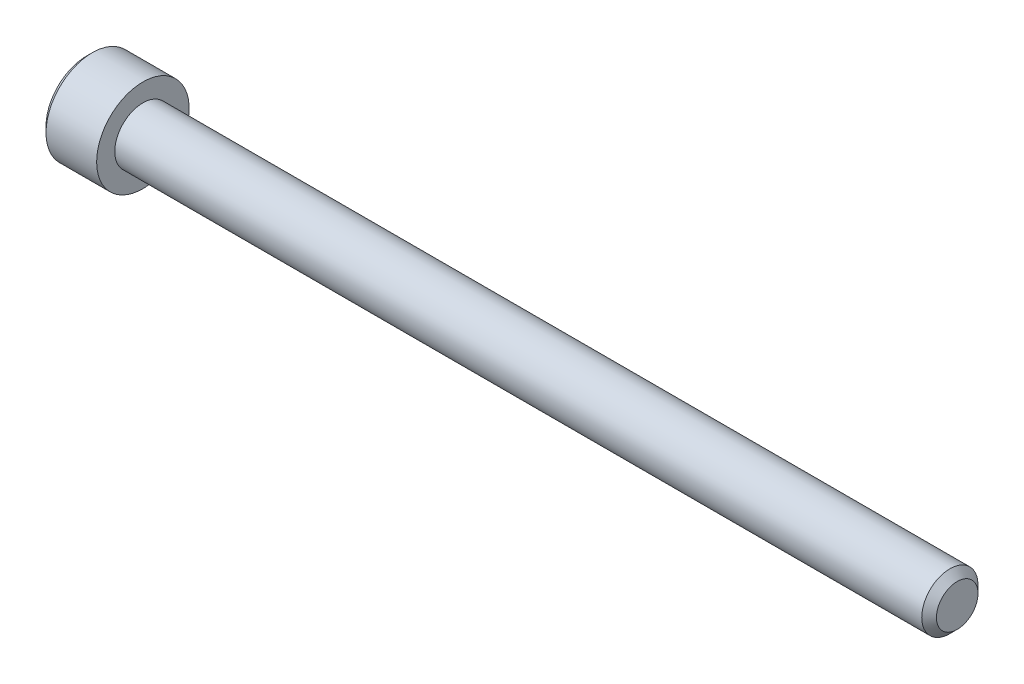
from build123d import *

# Parameters (mm, degrees)
HEXDRIVE_DEPTH = 2.286


with BuildPart() as part:
    # BodySketch → BaseBody (revolve)
    with BuildSketch(Plane(origin=(0, 0, 0), x_dir=(1, 0, 0), z_dir=(0, 1, 0)), mode=Mode.PRIVATE) as basebody_sk:
        Polygon((0, 2.413), (0, 3.96875), (-4.3434, 3.96875), (-4.826, 3.48615), (-4.826, 0), (69.85, 0), (69.85, 1.78308), (69.22008, 2.413), align=None)
    revolve(basebody_sk.sketch.rotate(Axis((-4.826, 0, 0), (1, 0, 0)), 180), axis=Axis((-4.826, 0, 0), (1, 0, 0)))

    # DriveSketch → HexDrive (cut)
    with BuildSketch(Plane.ZY.offset(4.826)):
        Polygon((2.292092116, 0), (1.146046058, 1.98501), (-1.146046058, 1.98501), (-2.292092116, 0), (-1.146046058, -1.98501), (1.146046058, -1.98501), align=None)
    extrude(amount=-HEXDRIVE_DEPTH, mode=Mode.SUBTRACT)


solid = part.part
